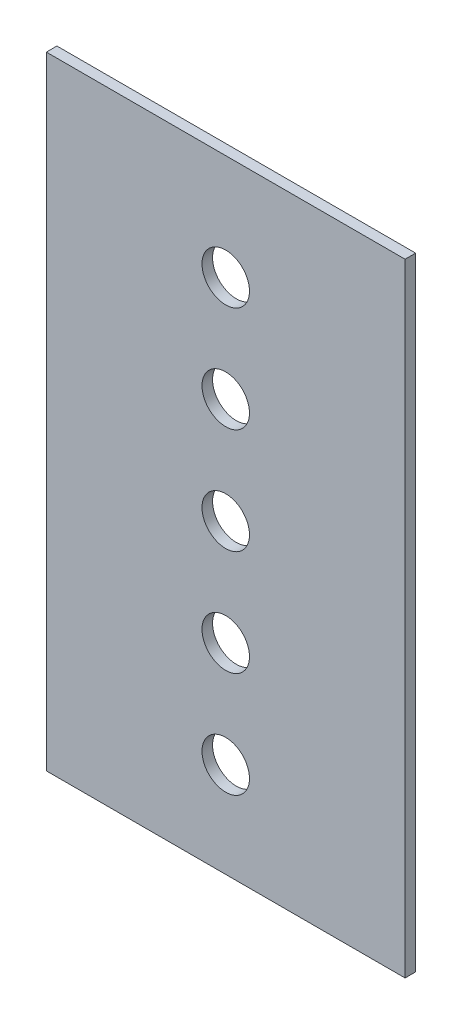
from build123d import *

# Parameters (mm, degrees)
SKETCH1_W           = 34
SKETCH1_H           = 59
SKETCH1_R           = 2.25
BOSS_EXTRUDE1_DEPTH = 1


with BuildPart() as part:
    # Sketch1 → Boss-Extrude1 (new body)
    with BuildSketch(Plane.XY):
        with Locations((-27, 20.25)):
            Rectangle(SKETCH1_W, SKETCH1_H)
        with Locations((-27, 39.75)):
            Circle(SKETCH1_R, mode=Mode.SUBTRACT)
        with Locations((-27, 29.75)):
            Circle(SKETCH1_R, mode=Mode.SUBTRACT)
        with Locations((-27, 19.75)):
            Circle(SKETCH1_R, mode=Mode.SUBTRACT)
        with Locations((-27, 9.749358603)):
            Circle(SKETCH1_R, mode=Mode.SUBTRACT)
        with Locations((-27, -0.250641397)):
            Circle(SKETCH1_R, mode=Mode.SUBTRACT)
    extrude(amount=BOSS_EXTRUDE1_DEPTH)


solid = part.part
